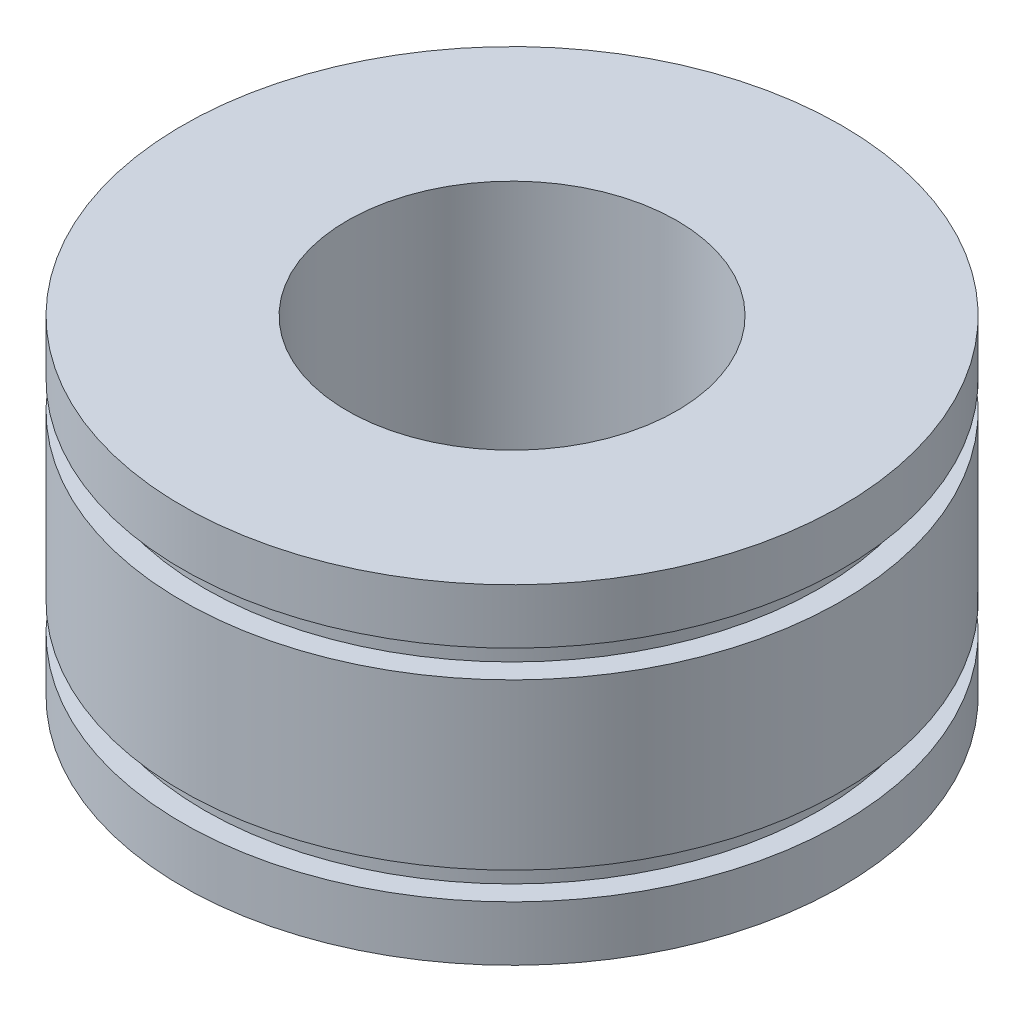
from build123d import *


with BuildPart() as part:
    # 草图1 → 旋转1 (revolve)
    with BuildSketch(Plane.XY, mode=Mode.PRIVATE) as revolve_1_sk:
        Polygon((1.5, 3), (1.5, 1.5), (3, 1.5), (3, 2.25), (2.8, 2.25), (2.8, 2.5), (3, 2.5), (3, 3), align=None)
        Polygon((1.5, 1.5), (1.5, 0), (3, 0), (3, 0.5), (2.8, 0.5), (2.8, 0.75), (3, 0.75), (3, 1.5), align=None)
    revolve(revolve_1_sk.sketch.rotate(Axis((0, 0, 0), (0, 1, 0)), 90), axis=Axis((0, 0, 0), (0, 1, 0)))


solid = part.part
